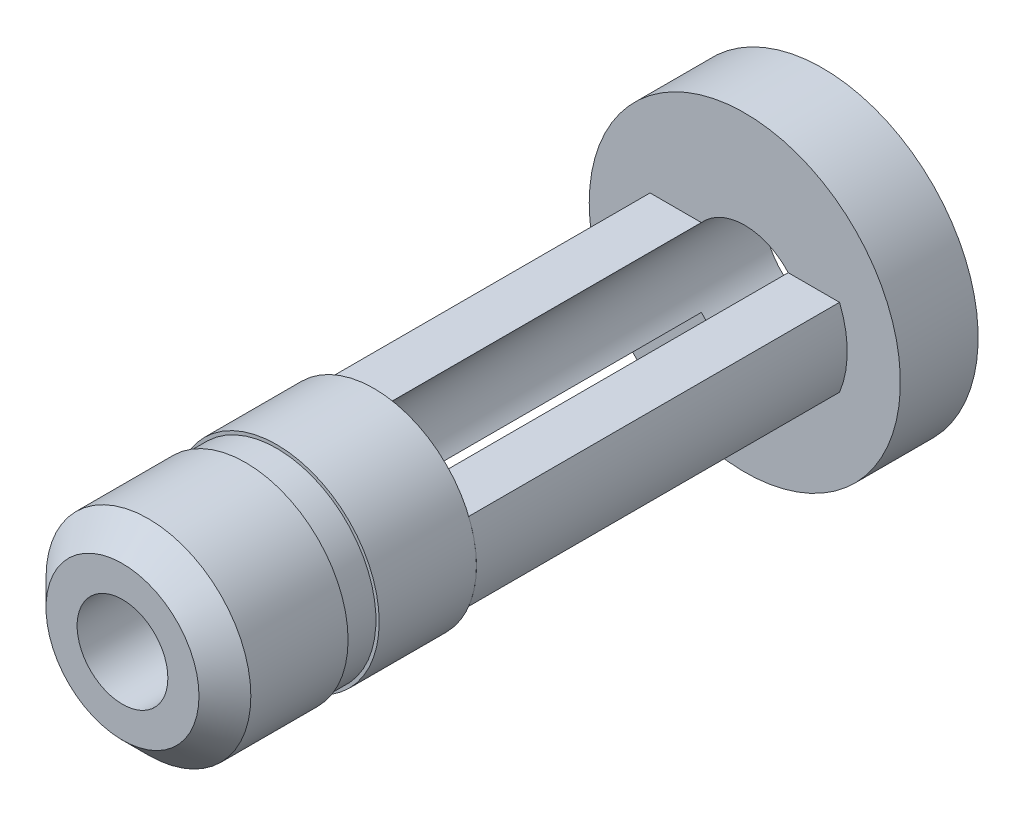
from build123d import *
from build123d.topology import SkipClean

# Parameters (mm, degrees)
SKETCH1_R           = 7.9
SKETCH1_R_2         = 3.5
BOSS_EXTRUDE1_DEPTH = 19.4
CHAMFER1_SIZE       = 2
CUT_EXTRUDE6_START  = 2.4
SKETCH19_R          = 7.9
SKETCH19_R_2        = 7.65
CUT_EXTRUDE6_DEPTH  = 2.4
SKETCH20_R          = 7.9
SKETCH20_R_2        = 4.5
BOSS_EXTRUDE3_DEPTH = 28.6
CUT_EXTRUDE7_DEPTH  = 28.6
SKETCH22_R          = 12
BOSS_EXTRUDE4_DEPTH = 6
SKETCH23_R          = 4.5
CUT_EXTRUDE8_DEPTH  = 6


with BuildPart() as part:
    # Sketch1 → Boss-Extrude1 (new body)
    with BuildSketch(Plane.XY):
        Circle(SKETCH1_R)
        Circle(SKETCH1_R_2, mode=Mode.SUBTRACT)
    extrude(amount=BOSS_EXTRUDE1_DEPTH)

    # Chamfer1
    chamfer1_edges = [part.edges().sort_by_distance(p)[0] for p in [
        (-7.9, 0, 19.4),
    ]]
    chamfer(chamfer1_edges, length=CHAMFER1_SIZE)

    # Sketch19 → Cut-Extrude6 (cut)
    with BuildSketch(Plane(origin=(0, 0, 9.9), x_dir=(-1, 0, 0), z_dir=(0, 0, -1)).offset(CUT_EXTRUDE6_START)):
        Circle(SKETCH19_R)
        Circle(SKETCH19_R_2, mode=Mode.SUBTRACT)
    extrude(amount=-CUT_EXTRUDE6_DEPTH, mode=Mode.SUBTRACT)


with BuildPart() as body_2:
    # Sketch20 → Boss-Extrude3 (new body)
    with BuildSketch(Plane(origin=(0, 0, 0), x_dir=(-1, 0, 0), z_dir=(0, 0, -1))):
        Circle(SKETCH20_R)
        Circle(SKETCH20_R_2, mode=Mode.SUBTRACT)
    extrude(amount=BOSS_EXTRUDE3_DEPTH)

    # Sketch21 → Cut-Extrude7 (cut)
    with BuildSketch(Plane(origin=(0, 0, -28.6), x_dir=(-1, 0, 0), z_dir=(0, 0, -1))):
        with BuildLine():
            Line((0, 3.004177824), (-7.306498176, 3.004177824))
            ThreePointArc((-7.306498176, 3.004177824), (0, 7.9), (7.306498176, 3.004177824))
            Line((7.306498176, 3.004177824), (0, 3.004177824))
        make_face()
        with BuildLine():
            Line((-7.308050668, -3.000399212), (0, -3.000399212))
            Line((0, -3.000399212), (7.308050668, -3.000399212))
            ThreePointArc((7.308050668, -3.000399212), (0, -7.9), (-7.308050668, -3.000399212))
        make_face()
    extrude(amount=-CUT_EXTRUDE7_DEPTH, mode=Mode.SUBTRACT)


with BuildPart() as cut_extrude7_piece_1:
    # of the separate pieces the step leaves, piece 1, a body of its own (cut_extrude7_pieces)
    add(body_2.part.solids().sort_by_distance((-7.308050668, -3.000399212, 0))[0])



with BuildPart() as cut_extrude7_piece_2:
    # of the separate pieces the step leaves, piece 2, a body of its own (cut_extrude7_pieces)
    add(body_2.part.solids().sort_by_distance((7.306498176, 3.004177824, 0))[0])


with BuildPart() as cut_extrude7_piece_1_1:
    add(cut_extrude7_piece_1.part)

    add(cut_extrude7_piece_2.part)  # Boss-Extrude4 merges Cut-Extrude7 piece 2
    # Sketch22 → Boss-Extrude4 (add)
    with BuildSketch(Plane(origin=(0, 0, -28.6), x_dir=(-1, 0, 0), z_dir=(0, 0, -1))):
        Circle(SKETCH22_R)
    extrude(amount=BOSS_EXTRUDE4_DEPTH)

    # Sketch23 → Cut-Extrude8 (cut)
    with SkipClean():  # the faces are left unmerged after this step: merging them gives an invalid solid
        with BuildSketch(Plane(origin=(0, 0, -34.6), x_dir=(-1, 0, 0), z_dir=(0, 0, -1))):
            with Locations(Location((0, 0, 0), (0, 0, 221.817134721))):
                Circle(SKETCH23_R)
        extrude(amount=-CUT_EXTRUDE8_DEPTH, mode=Mode.SUBTRACT)


solid = Compound([part.part, cut_extrude7_piece_1_1.part])
